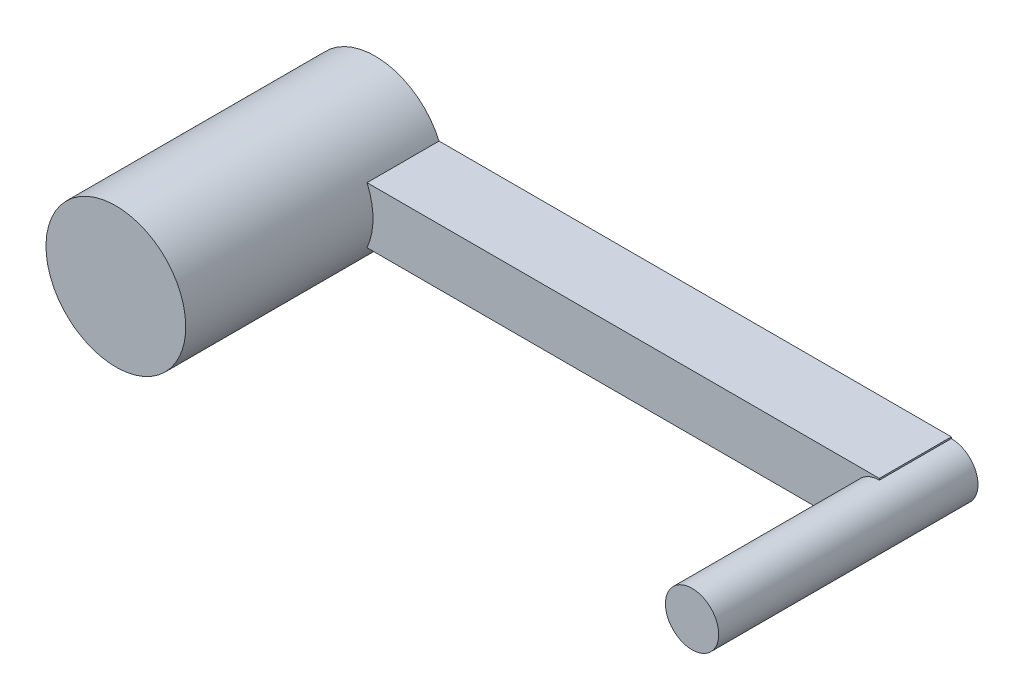
from build123d import *

# Parameters (mm, degrees)
BOSS_EXTRUDE1_DEPTH = 5
SKETCH1_3_R         = 4.85
SKETCH1_3_R_2       = 1.85
BOSS_EXTRUDE2_DEPTH = 18


with BuildPart() as part:
    # Sketch1 → Boss-Extrude1 (new body)
    with BuildSketch(Plane.XY):
        with BuildLine():
            Line((40, 0), (4.437851134, 0))
            ThreePointArc((4.437851134, 0), (4.745844393, -0.956791275), (4.85, -1.956521739))
            ThreePointArc((4.85, -1.956521739), (4.745844393, -2.956252203), (4.437851134, -3.913043478))
            Line((4.437851134, -3.913043478), (40, -3.913043478))
            Line((40, -3.913043478), (40, -3.806521739))
            ThreePointArc((40, -3.806521739), (38.15, -1.956521739), (40, -0.106521739))
            Line((40, -0.106521739), (40, 0))
        make_face()
    extrude(amount=BOSS_EXTRUDE1_DEPTH)

    # Sketch1<3> → Boss-Extrude2 (add)
    with BuildSketch(Plane.XY):
        with Locations((0, -1.956521739)):
            Circle(SKETCH1_3_R)
        with Locations((40, -1.956521739)):
            Circle(SKETCH1_3_R_2)
    extrude(amount=BOSS_EXTRUDE2_DEPTH)


solid = part.part
